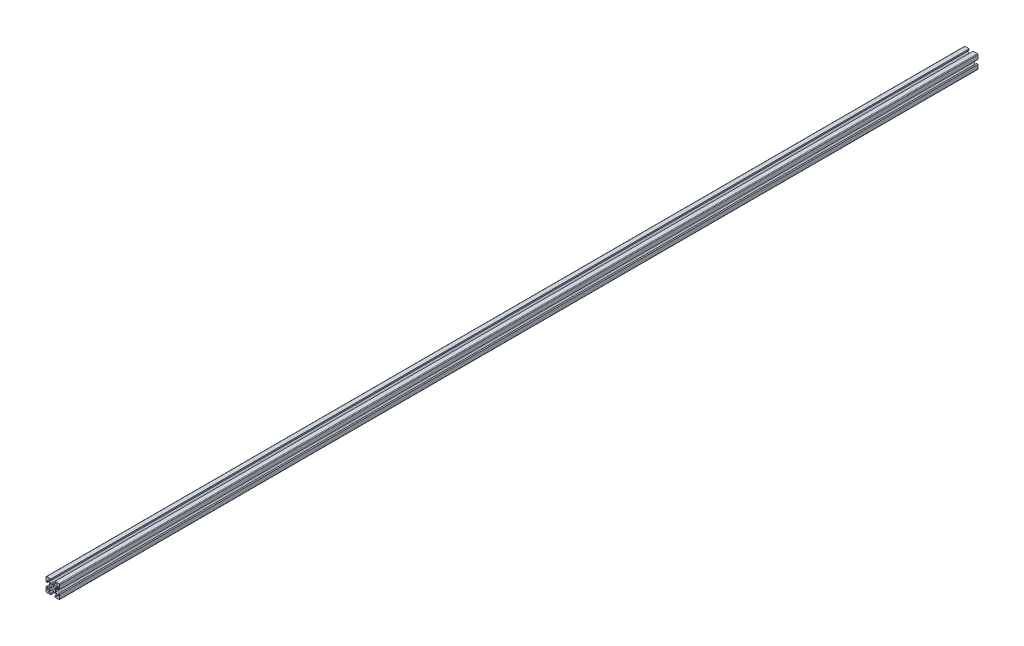
from build123d import *

# Parameters (mm, degrees)
SKETCH1_R           = 2.1
BOSS_EXTRUDE1_DEPTH = 1340


with BuildPart() as part:
    # Sketch1 → Boss-Extrude1 (new body)
    with BuildSketch(Plane(origin=(0, 0, -2000), x_dir=(-1, 0, 0), z_dir=(0, 0, -1))):
        with BuildLine():
            Line((10, -3), (8, -3))
            Line((8, -3), (8, -6))
            Line((8, -6), (7.060660172, -6))
            Line((7.060660172, -6), (4, -2.939339828))
            Line((4, -2.939339828), (4, -2.5))
            Line((4, -2.5), (3.750976592, -1.218885629))
            Line((3.750976592, -1.218885629), (3.933012702, -0.903589838))
            ThreePointArc((3.933012702, -0.903589838), (4, -0.653589838), (3.933012702, -0.403589838))
            Line((3.933012702, -0.403589838), (3.7, 0))
            Line((3.7, 0), (3.933012702, 0.403589838))
            ThreePointArc((3.933012702, 0.403589838), (3.982962913, 0.524180316), (4, 0.653589838))
            Line((4, 0.653589838), (4, 2.939339828))
            Line((4, 2.939339828), (7.060660172, 6))
            Line((7.060660172, 6), (8, 6))
            Line((8, 6), (8, 3))
            Line((8, 3), (10, 3))
            Line((10, 3), (10, 9))
            ThreePointArc((10, 9), (9.707106781, 9.707106781), (9, 10))
            Line((9, 10), (3, 10))
            Line((3, 10), (3, 8))
            Line((3, 8), (6, 8))
            Line((6, 8), (6, 7.060660172))
            Line((6, 7.060660172), (2.939339828, 4))
            Line((2.939339828, 4), (2.5, 4))
            Line((2.5, 4), (1.218885629, 3.750976592))
            Line((1.218885629, 3.750976592), (0.903589838, 3.933012702))
            ThreePointArc((0.903589838, 3.933012702), (0.653589838, 4), (0.403589838, 3.933012702))
            Line((0.403589838, 3.933012702), (0, 3.7))
            Line((0, 3.7), (-0.403589838, 3.933012702))
            ThreePointArc((-0.403589838, 3.933012702), (-0.524180316, 3.982962913), (-0.653589838, 4))
            Line((-0.653589838, 4), (-2.939339828, 4))
            Line((-2.939339828, 4), (-6, 7.060660172))
            Line((-6, 7.060660172), (-6, 8))
            Line((-6, 8), (-3, 8))
            Line((-3, 8), (-3, 10))
            Line((-3, 10), (-9, 10))
            ThreePointArc((-9, 10), (-9.707106781, 9.707106781), (-10, 9))
            Line((-10, 9), (-10, 3))
            Line((-10, 3), (-8, 3))
            Line((-8, 3), (-8, 6))
            Line((-8, 6), (-7.060660172, 6))
            Line((-7.060660172, 6), (-4, 2.939339828))
            Line((-4, 2.939339828), (-4, 2.5))
            Line((-4, 2.5), (-3.750976592, 1.218885629))
            Line((-3.750976592, 1.218885629), (-3.933012702, 0.903589838))
            ThreePointArc((-3.933012702, 0.903589838), (-4, 0.653589838), (-3.933012702, 0.403589838))
            Line((-3.933012702, 0.403589838), (-3.7, 0))
            Line((-3.7, 0), (-3.933012702, -0.403589838))
            ThreePointArc((-3.933012702, -0.403589838), (-3.982962913, -0.524180316), (-4, -0.653589838))
            Line((-4, -0.653589838), (-4, -2.939339828))
            Line((-4, -2.939339828), (-7.060660172, -6))
            Line((-7.060660172, -6), (-8, -6))
            Line((-8, -6), (-8, -3))
            Line((-8, -3), (-10, -3))
            Line((-10, -3), (-10, -9))
            ThreePointArc((-10, -9), (-9.707106781, -9.707106781), (-9, -10))
            Line((-9, -10), (-3, -10))
            Line((-3, -10), (-3, -8))
            Line((-3, -8), (-6, -8))
            Line((-6, -8), (-6, -7.060660172))
            Line((-6, -7.060660172), (-2.939339828, -4))
            Line((-2.939339828, -4), (-2.5, -4))
            Line((-2.5, -4), (-1.218885629, -3.750976592))
            Line((-1.218885629, -3.750976592), (-0.903589838, -3.933012702))
            ThreePointArc((-0.903589838, -3.933012702), (-0.653589838, -4), (-0.403589838, -3.933012702))
            Line((-0.403589838, -3.933012702), (0, -3.7))
            Line((0, -3.7), (0.403589838, -3.933012702))
            ThreePointArc((0.403589838, -3.933012702), (0.524180316, -3.982962913), (0.653589838, -4))
            Line((0.653589838, -4), (2.939339828, -4))
            Line((2.939339828, -4), (6, -7.060660172))
            Line((6, -7.060660172), (6, -8))
            Line((6, -8), (3, -8))
            Line((3, -8), (3, -10))
            Line((3, -10), (9, -10))
            ThreePointArc((9, -10), (9.707106781, -9.707106781), (10, -9))
            Line((10, -9), (10, -3))
        make_face()
        with Locations(Location((0, 0, 0), (0, 0, 180))):
            Circle(SKETCH1_R, mode=Mode.SUBTRACT)
    extrude(amount=-BOSS_EXTRUDE1_DEPTH)


solid = part.part
